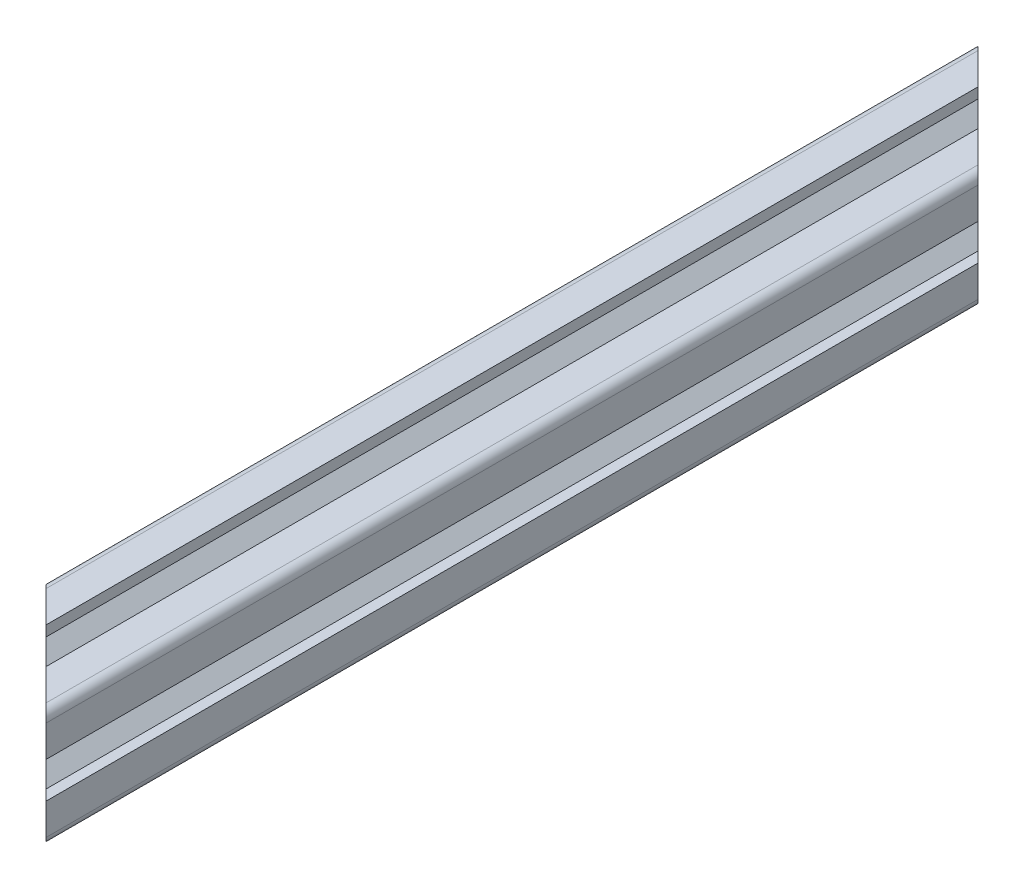
from build123d import *

# Parameters (mm, degrees)
SKETCH_1_R          = 2.5
EXTRUDE_1_DEPTH     = 180
CUT_EXTRUDE_1_DEPTH = 182.383571472


with BuildPart() as part:
    # 草图1 → 凸台-拉伸1 (new body)
    with BuildSketch(Plane.XY):
        with BuildLine():
            Line((-8.2, -3.1), (-10, -3.1))
            Line((-10, -3.1), (-10, -8.5))
            ThreePointArc((-10, -8.5), (-9.560660172, -9.560660172), (-8.5, -10))
            Line((-8.5, -10), (-3.1, -10))
            Line((-3.1, -10), (-3.1, -8.2))
            Line((-3.1, -8.2), (-5.5, -8.2))
            Line((-5.5, -8.2), (-5.5, -6.397050155))
            Line((-5.5, -6.397050155), (-2.202949845, -3.1))
            Line((-2.202949845, -3.1), (2.202949845, -3.1))
            Line((2.202949845, -3.1), (5.5, -6.397050155))
            Line((5.5, -6.397050155), (5.5, -8.2))
            Line((5.5, -8.2), (3.1, -8.2))
            Line((3.1, -8.2), (3.1, -10))
            Line((3.1, -10), (8.5, -10))
            ThreePointArc((8.5, -10), (9.560660172, -9.560660172), (10, -8.5))
            Line((10, -8.5), (10, -3.1))
            Line((10, -3.1), (8.2, -3.1))
            Line((8.2, -3.1), (8.2, -5.5))
            Line((8.2, -5.5), (6.397050155, -5.5))
            Line((6.397050155, -5.5), (3.05412702, -2.157076865))
            Line((3.05412702, -2.157076865), (3.05412702, 2.157076865))
            Line((3.05412702, 2.157076865), (6.397050155, 5.5))
            Line((6.397050155, 5.5), (8.2, 5.5))
            Line((8.2, 5.5), (8.2, 3.1))
            Line((8.2, 3.1), (10, 3.1))
            Line((10, 3.1), (10, 8.5))
            ThreePointArc((10, 8.5), (9.560660172, 9.560660172), (8.5, 10))
            Line((8.5, 10), (3.1, 10))
            Line((3.1, 10), (3.1, 8.2))
            Line((3.1, 8.2), (5.5, 8.2))
            Line((5.5, 8.2), (5.5, 6.397050155))
            Line((5.5, 6.397050155), (2.202949845, 3.1))
            Line((2.202949845, 3.1), (-2.202949845, 3.1))
            Line((-2.202949845, 3.1), (-5.5, 6.397050155))
            Line((-5.5, 6.397050155), (-5.5, 8.2))
            Line((-5.5, 8.2), (-3.1, 8.2))
            Line((-3.1, 8.2), (-3.1, 10))
            Line((-3.1, 10), (-8.5, 10))
            ThreePointArc((-8.5, 10), (-9.560660172, 9.560660172), (-10, 8.5))
            Line((-10, 8.5), (-10, 3.1))
            Line((-10, 3.1), (-8.2, 3.1))
            Line((-8.2, 3.1), (-8.2, 5.5))
            Line((-8.2, 5.5), (-6.397050155, 5.5))
            Line((-6.397050155, 5.5), (-3.05412702, 2.157076865))
            Line((-3.05412702, 2.157076865), (-3.05412702, -2.157076865))
            Line((-3.05412702, -2.157076865), (-6.397050155, -5.5))
            Line((-6.397050155, -5.5), (-8.2, -5.5))
            Line((-8.2, -5.5), (-8.2, -3.1))
        make_face()
        with Locations(Location((0, 0, 0), (0, 0, 180))):
            Circle(SKETCH_1_R, mode=Mode.SUBTRACT)
    extrude(amount=EXTRUDE_1_DEPTH)

    # 草图2 → 切除-拉伸1 (cut, through all)
    with BuildSketch(Plane(origin=(0, 10, 0), x_dir=(1, 0, 0), z_dir=(0, 1, 0))):
        Polygon((-10, 0), (10, 0), (10, -20), align=None)
        Polygon((-10, -180), (-10, -160), (10, -180), align=None)
    extrude(amount=-CUT_EXTRUDE_1_DEPTH, mode=Mode.SUBTRACT)


solid = part.part
